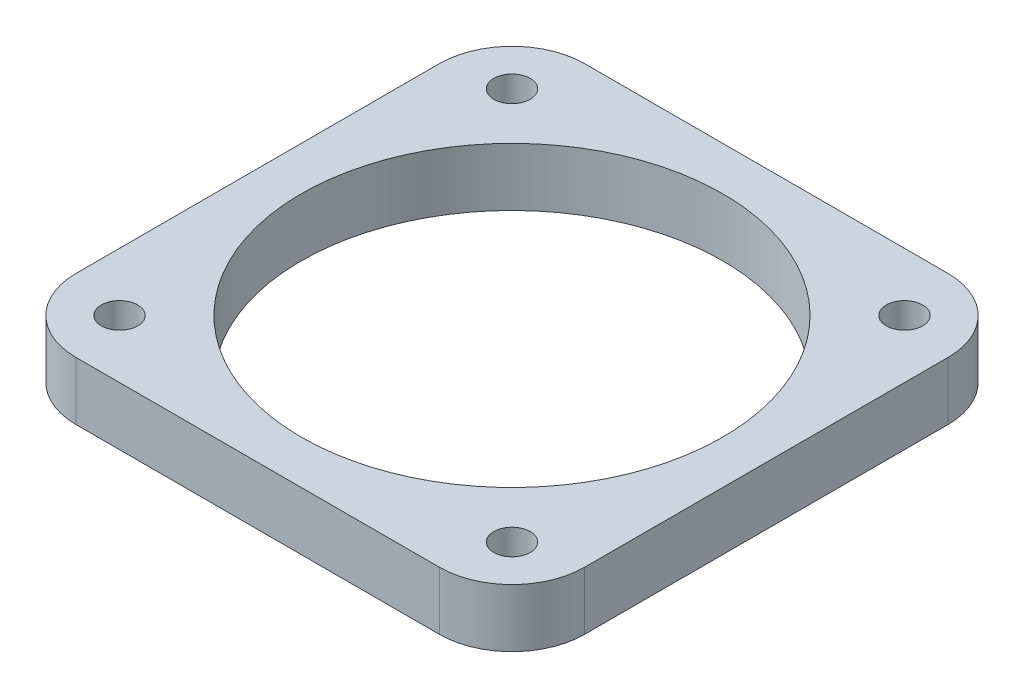
from build123d import *

# Parameters (mm, degrees)
CROQUIS1_R              = 35
CROQUIS1_R_2            = 29
SALIENTE_EXTRUIR1_DEPTH = 8
REDONDEO1_R             = 10
CROQUIS2_R              = 2.5
CORTAR_EXTRUIR1_DEPTH   = 10


with BuildPart() as part:
    # Croquis1 → Saliente-Extruir1 (new body)
    # profile 1 of 5: a face of its own
    with BuildSketch(Plane(origin=(0, 0, 0), x_dir=(1, 0, 0), z_dir=(0, 1, 0))):
        Circle(CROQUIS1_R)
        with Locations(Location((0, 0, 0), (0, 0, 270))):
            Circle(CROQUIS1_R_2, mode=Mode.SUBTRACT)
    # profile 2 of 5: a face of its own
    with BuildSketch(Plane(origin=(0, 0, 0), x_dir=(1, 0, 0), z_dir=(0, 1, 0))):
        with BuildLine():
            ThreePointArc((-1.9e-08, -35), (-24.748737387, -24.748737296), (-35, 1.1e-07))
            Line((-35, 1.1e-07), (-35, -35))
            Line((-35, -35), (-1.9e-08, -35))
        make_face()
    # profile 3 of 5: a face of its own
    with BuildSketch(Plane(origin=(0, 0, 0), x_dir=(1, 0, 0), z_dir=(0, 1, 0))):
        with BuildLine():
            Line((35, -35), (35, 0))
            ThreePointArc((35, 0), (24.748737335, -24.748737348), (-1.9e-08, -35))
            Line((-1.9e-08, -35), (35, -35))
        make_face()
    # profile 4 of 5: a face of its own
    with BuildSketch(Plane(origin=(0, 0, 0), x_dir=(1, 0, 0), z_dir=(0, 1, 0))):
        with BuildLine():
            Line((35, 35), (1.1e-08, 35))
            ThreePointArc((1.1e-08, 35), (24.748737345, 24.748737338), (35, 0))
            Line((35, 0), (35, 35))
        make_face()
    # profile 5 of 5: a face of its own
    with BuildSketch(Plane(origin=(0, 0, 0), x_dir=(1, 0, 0), z_dir=(0, 1, 0))):
        with BuildLine():
            Line((1.1e-08, 35), (-35, 35))
            Line((-35, 35), (-35, 1.1e-07))
            ThreePointArc((-35, 1.1e-07), (-24.748737299, 24.748737384), (1.1e-08, 35))
        make_face()
    extrude(amount=SALIENTE_EXTRUIR1_DEPTH)

    # Redondeo1
    redondeo1_edges = [part.edges().sort_by_distance(p)[0] for p in [
        (-35, 4, -35),
        (35, 4, -35),
        (35, 4, 35),
        (-35, 4, 35),
    ]]
    fillet(redondeo1_edges, radius=REDONDEO1_R)

    # Croquis2 → Cortar-Extruir1 (cut)
    with BuildSketch(Plane(origin=(0, 8, 0), x_dir=(1, 0, 0), z_dir=(0, 1, 0))):
        with Locations(Location((-27, 27, 0), (0, 0, 270))):
            Circle(CROQUIS2_R)
        with Locations(Location((27, 27, 0), (0, 0, 270))):
            Circle(CROQUIS2_R)
        with Locations(Location((27, -27, 0), (0, 0, 270))):
            Circle(CROQUIS2_R)
        with Locations(Location((-27, -27, 0), (0, 0, 270))):
            Circle(CROQUIS2_R)
    extrude(amount=-CORTAR_EXTRUIR1_DEPTH, mode=Mode.SUBTRACT)


solid = part.part
